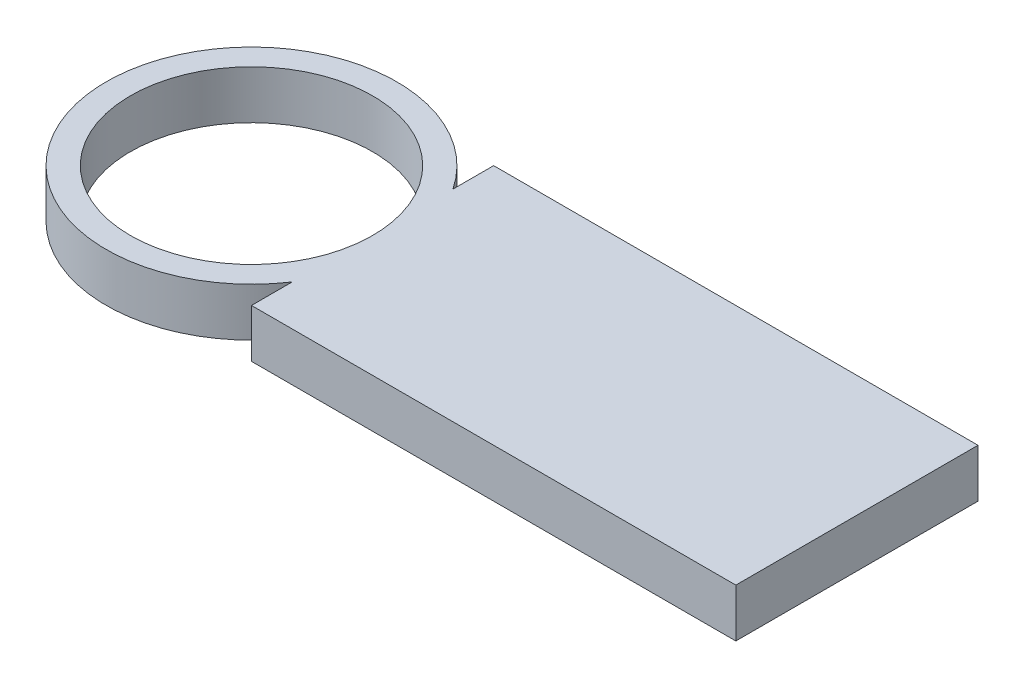
from build123d import *

# Parameters (mm, degrees)
SKETCH1_R           = 30
SKETCH1_R_2         = 25
BOSS_EXTRUDE1_DEPTH = 10
SKETCH3_W           = 100
SKETCH3_H           = 50
BOSS_EXTRUDE2_DEPTH = 10


with BuildPart() as part:
    # Sketch1 → Boss-Extrude1 (new body)
    with BuildSketch(Plane(origin=(0, 0, 0), x_dir=(1, 0, 0), z_dir=(0, 1, 0))):
        with Locations(Location((0, 0, 0), (0, 0, 270))):
            Circle(SKETCH1_R)
        with Locations(Location((0, 0, 0), (0, 0, 270))):
            Circle(SKETCH1_R_2, mode=Mode.SUBTRACT)
    extrude(amount=BOSS_EXTRUDE1_DEPTH)

    # Sketch3 → Boss-Extrude2 (add)
    with BuildSketch(Plane(origin=(0, 0, 0), x_dir=(1, 0, 0), z_dir=(0, 1, 0))):
        with Locations((75, 0)):
            Rectangle(SKETCH3_W, SKETCH3_H)
    extrude(amount=BOSS_EXTRUDE2_DEPTH)


solid = part.part
